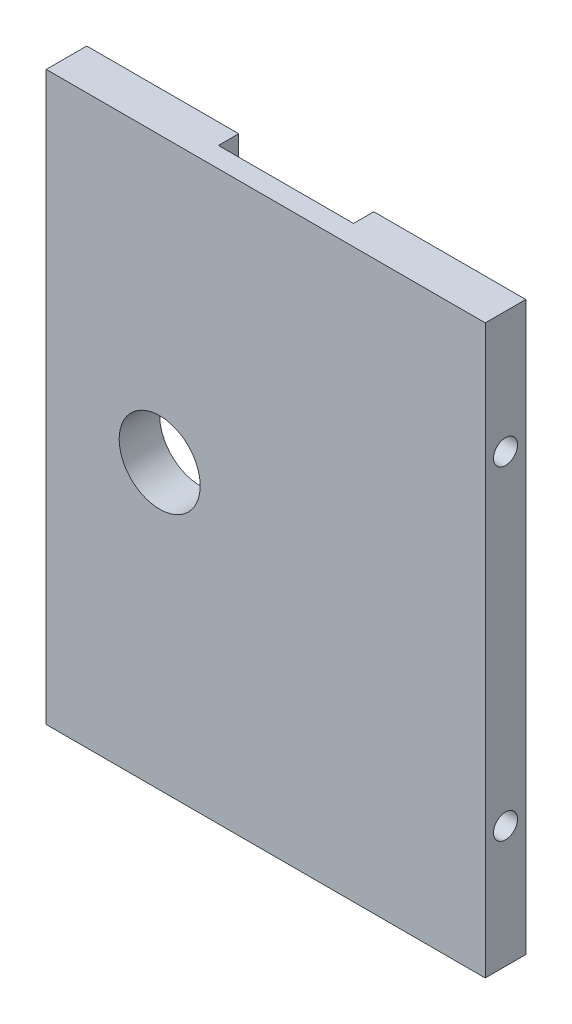
from build123d import *

# Parameters (mm, degrees)
SKETCH1_W                 = 32.5
SKETCH1_H                 = 42
BOSS_EXTRUDE2_DEPTH       = 3
F_2_56_TAPPED_HOLE1_D     = 1.778
F_2_56_TAPPED_HOLE1_DEPTH = 5.19583491
F_2_56_TAPPED_HOLE1_TIP   = 0.53416509
F_2_56_TAPPED_HOLE2_D     = 1.778
F_2_56_TAPPED_HOLE2_DEPTH = 5.19583491
F_2_56_TAPPED_HOLE2_TIP   = 0.53416509
CUT_EXTRUDE1_DEPTH        = 3
SKETCH10_W                = 10
SKETCH10_H                = 6.5
CUT_EXTRUDE2_DEPTH        = 1.5


with BuildPart() as part:
    # Sketch1 → Boss-Extrude2 (new body)
    with BuildSketch(Plane.XY):
        with Locations((16.25, 21)):
            Rectangle(SKETCH1_W, SKETCH1_H)
    extrude(amount=BOSS_EXTRUDE2_DEPTH)

    # #2-56 Tapped Hole1
    with Locations(Plane.ZY):
        with Locations((1.5, 33), (1.5, 9)):
            Hole(F_2_56_TAPPED_HOLE1_D / 2, depth=F_2_56_TAPPED_HOLE1_DEPTH)
            with Locations((0, 0, -(F_2_56_TAPPED_HOLE1_DEPTH + F_2_56_TAPPED_HOLE1_TIP / 2))):  # 118° drill point
                Cone(0, F_2_56_TAPPED_HOLE1_D / 2, F_2_56_TAPPED_HOLE1_TIP, mode=Mode.SUBTRACT)

    # #2-56 Tapped Hole2
    with Locations(Plane(origin=(32.5, 0, 0), x_dir=(0, 0, -1), z_dir=(1, 0, 0))):
        with Locations((-1.5, 33), (-1.5, 9)):
            Hole(F_2_56_TAPPED_HOLE2_D / 2, depth=F_2_56_TAPPED_HOLE2_DEPTH)
            with Locations((0, 0, -(F_2_56_TAPPED_HOLE2_DEPTH + F_2_56_TAPPED_HOLE2_TIP / 2))):  # 118° drill point
                Cone(0, F_2_56_TAPPED_HOLE2_D / 2, F_2_56_TAPPED_HOLE2_TIP, mode=Mode.SUBTRACT)

    # Sketch9 → Cut-Extrude1 (cut)
    with BuildSketch(Plane(origin=(0, 0, 0), x_dir=(-1, 0, 0), z_dir=(0, 0, -1))):
        with BuildLine():
            ThreePointArc((-11.4, 21), (-8.4, 18), (-5.4, 21))
            Line((-5.4, 21), (-8.4, 21))
            Line((-8.4, 21), (-11.4, 21))
        make_face()
        with BuildLine():
            Line((-8.4, 21), (-5.4, 21))
            ThreePointArc((-5.4, 21), (-8.4, 24), (-11.4, 21))
            Line((-11.4, 21), (-8.4, 21))
        make_face()
    extrude(amount=-CUT_EXTRUDE1_DEPTH, mode=Mode.SUBTRACT)

    # Sketch10 → Cut-Extrude2 (cut)
    with BuildSketch(Plane(origin=(0, 0, 0), x_dir=(-1, 0, 0), z_dir=(0, 0, -1))):
        with Locations((-16.25, 38.75)):
            Rectangle(SKETCH10_W, SKETCH10_H)
    extrude(amount=-CUT_EXTRUDE2_DEPTH, mode=Mode.SUBTRACT)


solid = part.part
